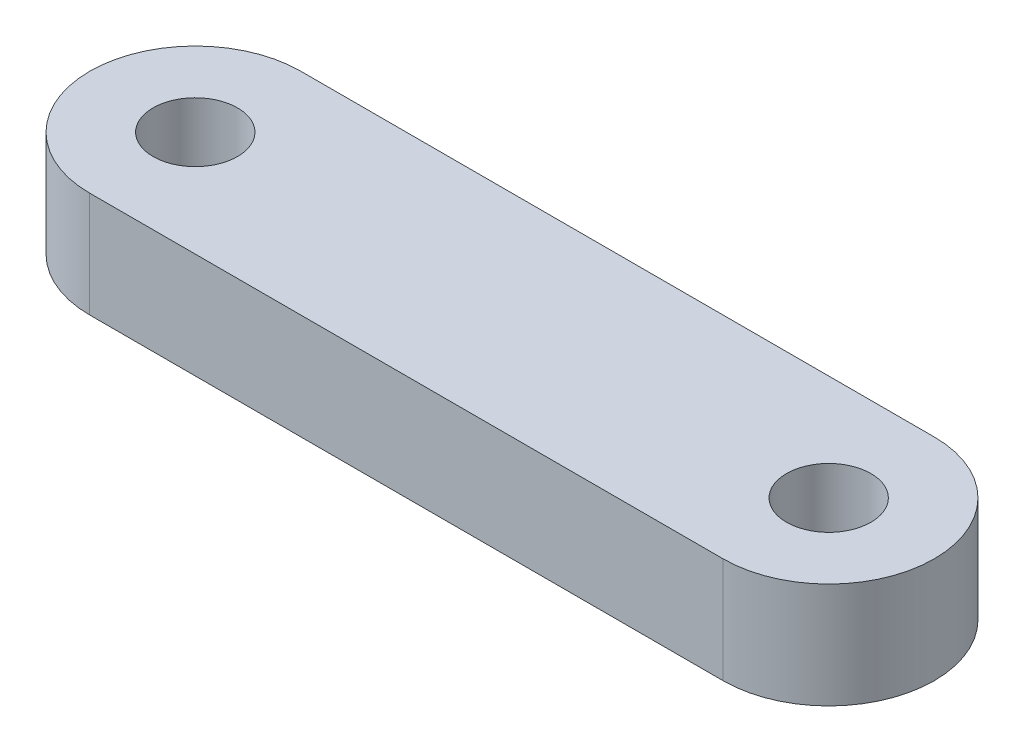
from build123d import *

# Parameters (mm, degrees)
BOSS_EXTRUDE1_DEPTH = 50
SKETCH2_R           = 20
CUT_EXTRUDE1_DEPTH  = 50


with BuildPart() as part:
    # Sketch1 → Boss-Extrude1 (new body)
    with BuildSketch(Plane(origin=(0, 0, 0), x_dir=(1, 0, 0), z_dir=(0, 1, 0))):
        with BuildLine():
            Line((-47.638258167, 50), (252.361741833, 50))
            ThreePointArc((252.361741833, 50), (302.361741833, 0), (252.361741833, -50))
            Line((252.361741833, -50), (-47.638258167, -50))
            ThreePointArc((-47.638258167, -50), (-97.638258167, 0), (-47.638258167, 50))
        make_face()
    extrude(amount=BOSS_EXTRUDE1_DEPTH)

    # Sketch2 → Cut-Extrude1 (cut)
    with BuildSketch(Plane(origin=(0, 50, 0), x_dir=(1, 0, 0), z_dir=(0, 1, 0))):
        with Locations(Location((-47.638258167, 0, 0), (0, 0, 270))):
            Circle(SKETCH2_R)
        with Locations(Location((252.361741833, 0, 0), (0, 0, 270))):
            Circle(SKETCH2_R)
    extrude(amount=-CUT_EXTRUDE1_DEPTH, mode=Mode.SUBTRACT)


solid = part.part
